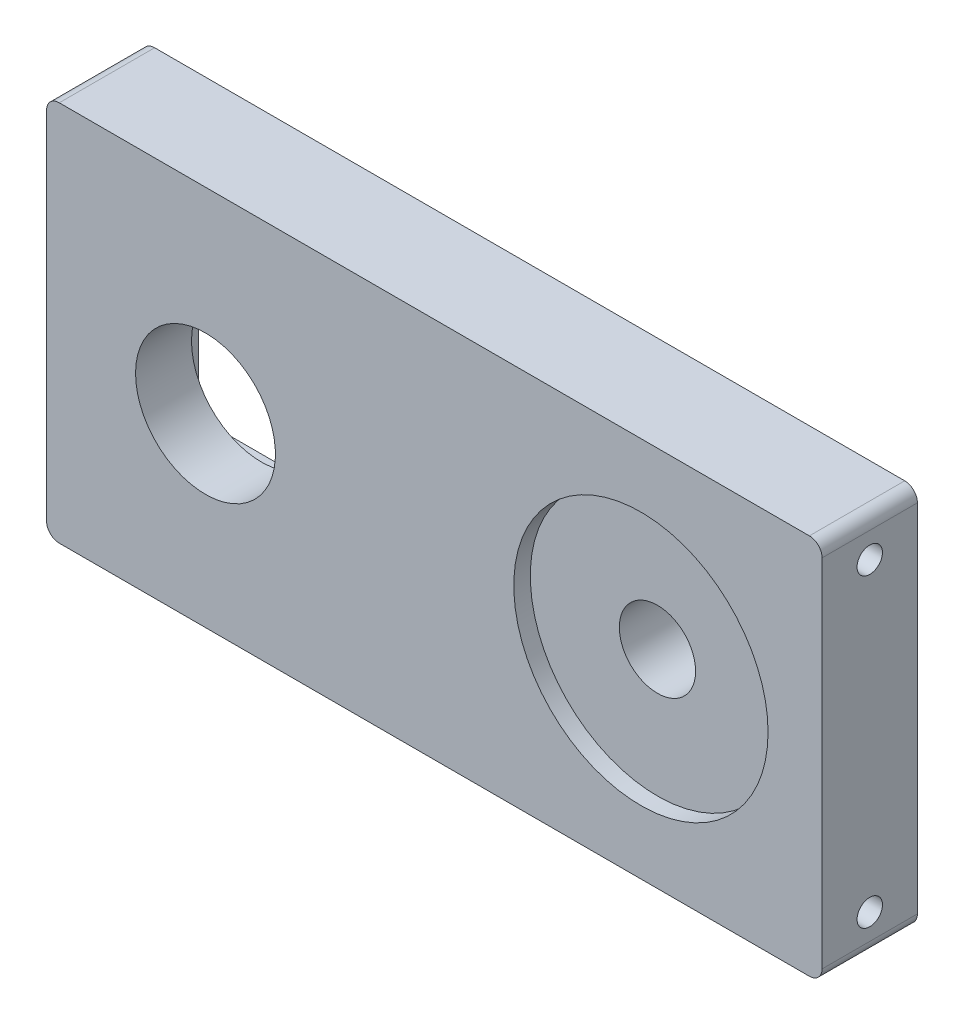
from build123d import *

# Parameters (mm, degrees)
BOSS_EXTRUDE1_DEPTH = 7.5
SKETCH2_R           = 2
CUT_EXTRUDE1_DEPTH  = 15
SKETCH3_R           = 11
CUT_EXTRUDE3_DEPTH  = 35
SKETCH4_R           = 6
CUT_EXTRUDE4_DEPTH  = 19.95
CUT_EXTRUDE5_DEPTH  = 6.2
SKETCH7_R           = 20
CUT_EXTRUDE6_DEPTH  = 2.6


with BuildPart() as part:
    # Sketch1 → Boss-Extrude1 (new, symmetric)
    with BuildSketch(Plane.XY):
        with BuildLine():
            Line((-59, 30), (59, 30))
            ThreePointArc((59, 30), (60.414213562, 29.414213562), (61, 28))
            Line((61, 28), (61, -28))
            ThreePointArc((61, -28), (60.414213562, -29.414213562), (59, -30))
            Line((59, -30), (-59, -30))
            ThreePointArc((-59, -30), (-60.414213562, -29.414213562), (-61, -28))
            Line((-61, -28), (-61, 28))
            ThreePointArc((-61, 28), (-60.414213562, 29.414213562), (-59, 30))
        make_face()
    extrude(amount=BOSS_EXTRUDE1_DEPTH, both=True)

    # Sketch2 → Cut-Extrude1 (cut)
    with BuildSketch(Plane(origin=(61, 0, 0), x_dir=(0, 0, -1), z_dir=(1, 0, 0))):
        with Locations(Location((0, 24, 0), (0, 0, 90))):
            Circle(SKETCH2_R)
        with Locations(Location((0, -24, 0), (0, 0, 270))):
            Circle(SKETCH2_R)
    extrude(amount=-CUT_EXTRUDE1_DEPTH, mode=Mode.SUBTRACT)

    # Sketch3 → Cut-Extrude3 (cut)
    with BuildSketch(Plane(origin=(0, 0, -7.5), x_dir=(-1, 0, 0), z_dir=(0, 0, -1))):
        with Locations((36, -0.850791996)):
            Circle(SKETCH3_R)
    extrude(amount=-CUT_EXTRUDE3_DEPTH, mode=Mode.SUBTRACT)

    # Sketch4 → Cut-Extrude4 (cut)
    with BuildSketch(Plane.XY.offset(7.5)):
        with Locations((32.5, 0)):
            Circle(SKETCH4_R)
    extrude(amount=-CUT_EXTRUDE4_DEPTH, mode=Mode.SUBTRACT)

    # Sketch6 → Cut-Extrude5 (cut)
    with BuildSketch(Plane(origin=(0, 0, -7.5), x_dir=(-1, 0, 0), z_dir=(0, 0, -1))):
        Polygon((49.1, 15.249208004), (52.1, 12.249208004), (52.1, -13.950791996), (49.1, -16.950791996), (22.9, -16.950791996), (19.9, -13.950791996), (19.9, 12.249208004), (22.9, 15.249208004), align=None)
    extrude(amount=-CUT_EXTRUDE5_DEPTH, mode=Mode.SUBTRACT)

    # Sketch7 → Cut-Extrude6 (cut)
    with BuildSketch(Plane.XY.offset(7.5)):
        with Locations((32.5, 0)):
            Circle(SKETCH7_R)
    extrude(amount=-CUT_EXTRUDE6_DEPTH, mode=Mode.SUBTRACT)


solid = part.part
